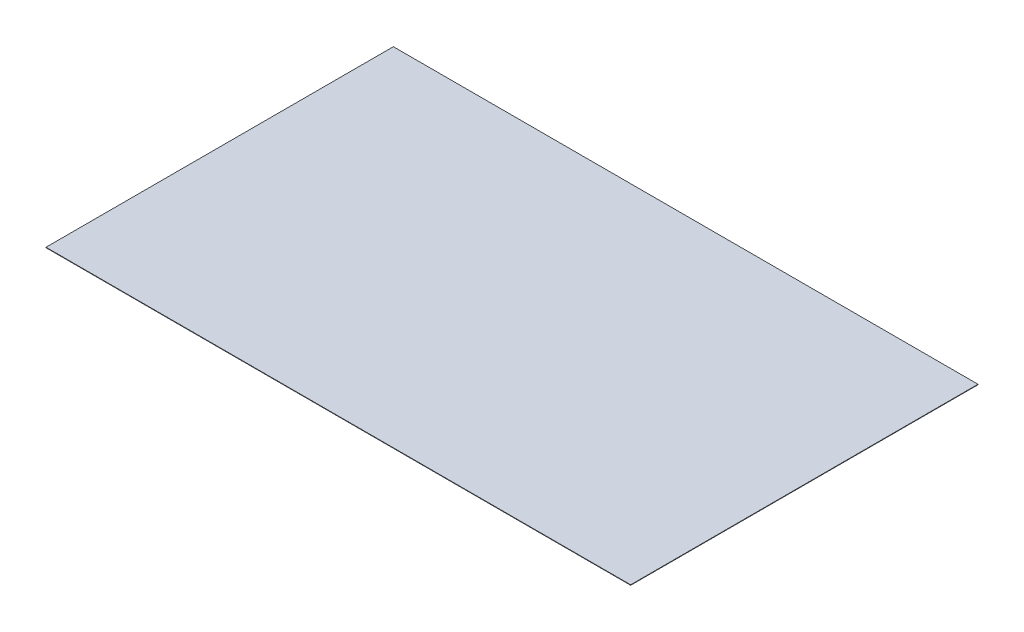
from build123d import *

# Parameters (mm, degrees)
SKETCH1_W                     = 1275
SKETCH1_H                     = 1
STORE_AYIRICI_SAC_ALT_1_DEPTH = 757.5


with BuildPart() as part:
    # Sketch1 → STORE_ayirici_sac_alt_1 (new body)
    with BuildSketch(Plane.XY):
        with Locations((700, 690.5)):
            Rectangle(SKETCH1_W, SKETCH1_H)
    extrude(amount=-STORE_AYIRICI_SAC_ALT_1_DEPTH)


solid = part.part
